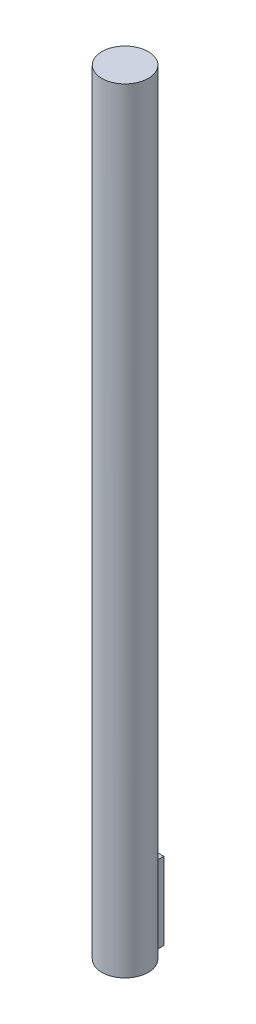
from build123d import *

# Parameters (mm, degrees)
SKETCH_1_R      = 3
EXTRUDE_1_DEPTH = 100
SKETCH_2_W      = 2
SKETCH_2_H      = 2
EXTRUDE_2_DEPTH = 10


with BuildPart() as part:
    # 스케치1 → 보스-돌출1 (new body)
    with BuildSketch(Plane(origin=(0, 0, 0), x_dir=(1, 0, 0), z_dir=(0, 1, 0))):
        with Locations(Location((0, 0, 0), (0, 0, 270))):
            Circle(SKETCH_1_R)
    extrude(amount=EXTRUDE_1_DEPTH)

    # 스케치2 → 보스-돌출2 (add)
    with BuildSketch(Plane(origin=(0, 0, 0), x_dir=(1, 0, 0), z_dir=(0, 1, 0))):
        with Locations((0, 3)):
            Rectangle(SKETCH_2_W, SKETCH_2_H)
    extrude(amount=EXTRUDE_2_DEPTH)


solid = part.part
